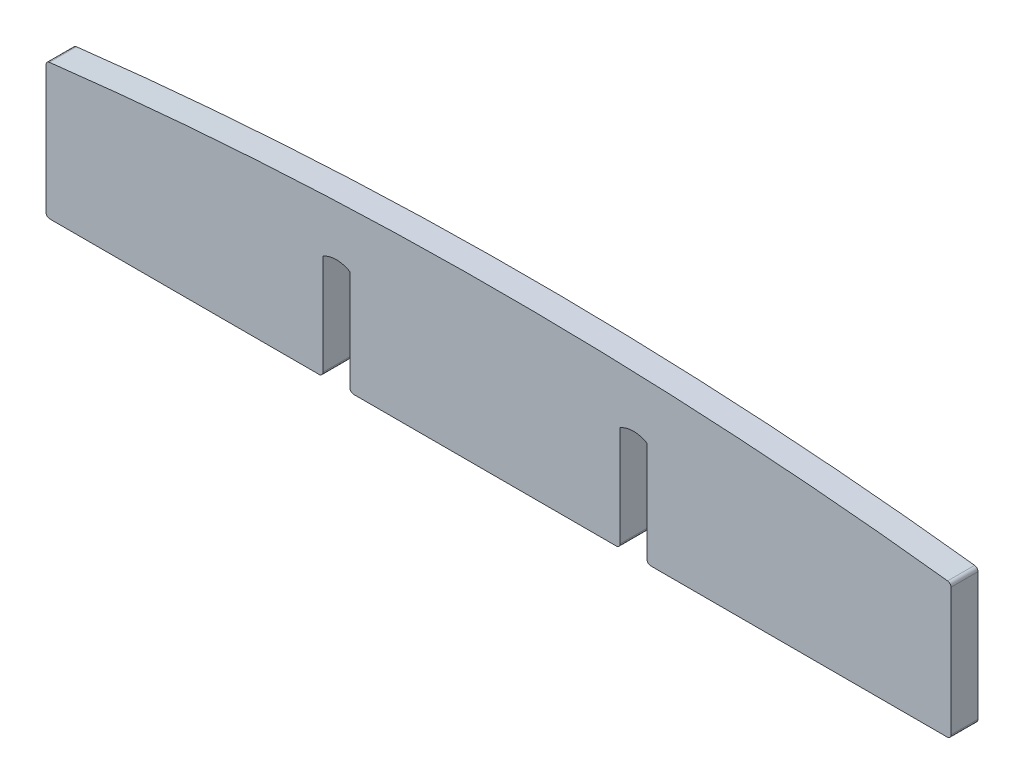
from build123d import *

# Parameters (mm, degrees)
RESSALTO_EXTRUS_O1_DEPTH = 2


with BuildPart() as part:
    # Esboço1 → Ressalto-extrusão1 (new body)
    with BuildSketch(Plane.XY):
        with BuildLine():
            Line((-9.717847221, -7.732050808), (9.717847221, -7.732050808))
            ThreePointArc((9.717847221, -7.732050808), (9.917359364, -7.649410172), (10, -7.449898029))
            Line((10, -7.449898029), (10, 0))
            ThreePointArc((10, 0), (11, 0.267949192), (12, 0))
            Line((12, 0), (12, -7.449898029))
            ThreePointArc((12, -7.449898029), (12.082640636, -7.649410172), (12.282152779, -7.732050808))
            Line((12.282152779, -7.732050808), (34.217847221, -7.732050808))
            ThreePointArc((34.217847221, -7.732050808), (34.417359364, -7.649410172), (34.5, -7.449898029))
            Line((34.5, -7.449898029), (34.5, 2.017476071))
            ThreePointArc((34.5, 2.017476071), (34.428811399, 2.204837503), (34.251168098, 2.297654424))
            ThreePointArc((34.251168098, 2.297654424), (1, 4.267949192), (-32.251168098, 2.297654424))
            ThreePointArc((-32.251168098, 2.297654424), (-32.428811399, 2.204837503), (-32.5, 2.017476071))
            Line((-32.5, 2.017476071), (-32.5, -7.449898029))
            ThreePointArc((-32.5, -7.449898029), (-32.417359364, -7.649410172), (-32.217847221, -7.732050808))
            Line((-32.217847221, -7.732050808), (-12.282152779, -7.732050808))
            ThreePointArc((-12.282152779, -7.732050808), (-12.082640636, -7.649410172), (-12, -7.449898029))
            Line((-12, -7.449898029), (-12, 0))
            ThreePointArc((-12, 0), (-11, 0.267949192), (-10, 0))
            Line((-10, 0), (-10, -7.449898029))
            ThreePointArc((-10, -7.449898029), (-9.917359364, -7.649410172), (-9.717847221, -7.732050808))
        make_face()
    extrude(amount=RESSALTO_EXTRUS_O1_DEPTH)


solid = part.part
